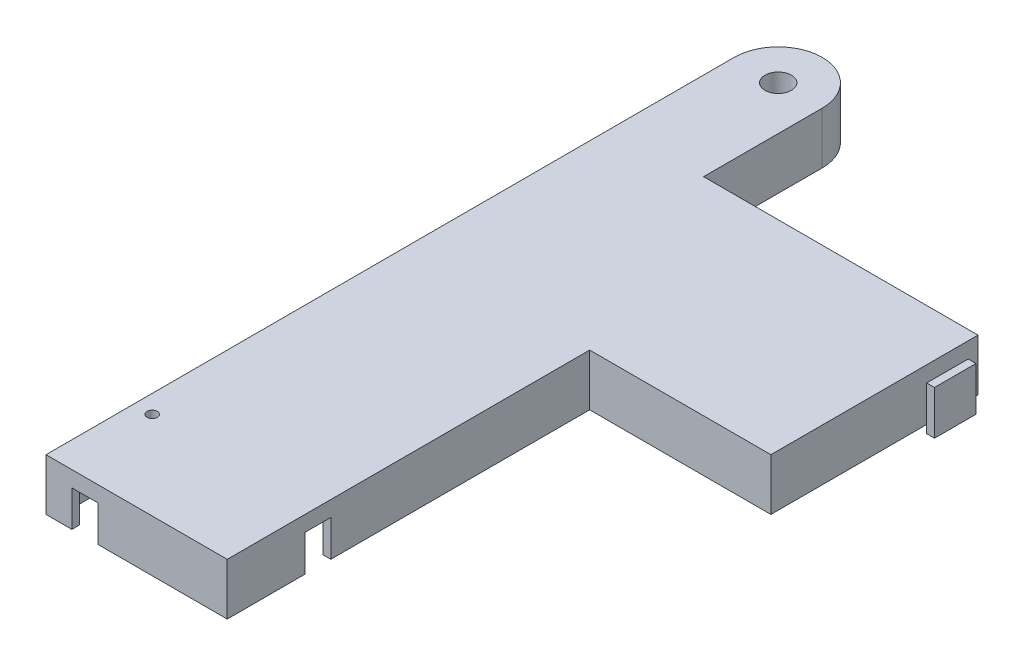
from build123d import *

# Parameters (mm, degrees)
CORNERBOSS_EXTRUDE1_DEPTH               = 20
SHELL2_T                                = -3
PADSKETCH3_R                            = 12
PADSKETCH3_R_2                          = 5
PADBOSS_EXTRUDE2_DEPTH                  = 10
STEPPERSHAFTHOLESKETCH4_R               = 5.1
STEPPERSHAFTHOLESKETCH4_R_2             = 2
STEPPERSHAFTCUT_EXTRUDE2_DEPTH          = 316.846451025
THREADEDNUTMOUNTHOLESSKETCH5_R          = 2
THREADEDNUTMOUNTHOLESCUT_EXTRUDE4_DEPTH = 10
TRPEGSKETCH1_W                          = 9.8
TRPEGSKETCH1_H                          = 13.9
TRPEGBOSS_EXTRUDE1_DEPTH                = 3.1
TRPEGCAPSKETCH2_W                       = 16
TRPEGCAPSKETCH2_H                       = 17
TRPEGCAPBOSS_EXTRUDE2_DEPTH             = 3
BOTTOMPEGHOLESKETCH3_W                  = 10
BOTTOMPEGHOLESKETCH3_H                  = 13.9
BOTTOMPEGHOLECUT_EXTRUDE1_DEPTH         = 3
BEDCENTERPEGHOLECUTSKETCH1_W            = 10
BEDCENTERPEGHOLECUTSKETCH1_H            = 14
BEDCENTERPEGHOLECUT_EXTRUDE1_DEPTH      = 3


with BuildPart() as part:
    # CornerrSketch1 → CornerBoss-Extrude1 (new body)
    with BuildSketch(Plane(origin=(0, 0, 0), x_dir=(1, 0, 0), z_dir=(0, 1, 0))):
        with BuildLine():
            Line((140, 220), (140, 140))
            Line((140, 140), (70, 140))
            Line((70, 140), (70, 0))
            Line((70, 0), (0, 0))
            Line((0, 0), (0, 265.825))
            ThreePointArc((0, 265.825), (17, 282.825), (34, 265.825))
            Line((34, 265.825), (34, 220))
            Line((34, 220), (140, 220))
        make_face()
    extrude(amount=CORNERBOSS_EXTRUDE1_DEPTH)

    # Shell2
    shell2_openings = [part.faces().sort_by_distance(p)[0] for p in [
        (50.460788317, 0, -139.249856422),
    ]]
    offset(amount=SHELL2_T, openings=shell2_openings, kind=Kind.INTERSECTION)

    # PadSketch3 → PadBoss-Extrude2 (add)
    with BuildSketch(Plane.XZ.offset(-17)):
        with Locations(Location((17, -265.825, 0), (0, 0, 90))):
            Circle(PADSKETCH3_R)
        with Locations((7, -34)):
            Circle(PADSKETCH3_R_2)
    extrude(amount=PADBOSS_EXTRUDE2_DEPTH)

    # StepperShaftHoleSketch4 → StepperShaftCut-Extrude2 (cut, through all)
    with BuildSketch(Plane.XZ.offset(-7)):
        with Locations(Location((17, -265.825, 0), (0, 0, 270))):
            Circle(STEPPERSHAFTHOLESKETCH4_R)
        with Locations(Location((7, -34, 0), (0, 0, 270))):
            Circle(STEPPERSHAFTHOLESKETCH4_R_2)
    extrude(amount=-STEPPERSHAFTCUT_EXTRUDE2_DEPTH, mode=Mode.SUBTRACT)

    # ThreadedNutMountHolesSketch5 → ThreadedNutMountHolesCut-Extrude4 (cut)
    with BuildSketch(Plane(origin=(0, 7, 0), x_dir=(-1, 0, 0), z_dir=(0, -1, 0))):
        with Locations(Location((-17, 273.825, 0), (0, 0, 90))):
            Circle(THREADEDNUTMOUNTHOLESSKETCH5_R)
        with Locations(Location((-9, 265.825, 0), (0, 0, 90))):
            Circle(THREADEDNUTMOUNTHOLESSKETCH5_R)
        with Locations(Location((-17, 257.825, 0), (0, 0, 90))):
            Circle(THREADEDNUTMOUNTHOLESSKETCH5_R)
        with Locations(Location((-25, 265.825, 0), (0, 0, 90))):
            Circle(THREADEDNUTMOUNTHOLESSKETCH5_R)
    extrude(amount=-THREADEDNUTMOUNTHOLESCUT_EXTRUDE4_DEPTH, mode=Mode.SUBTRACT)

    # TRPegSketch1 → TRPegBoss-Extrude1 (add)
    with BuildSketch(Plane(origin=(140, 0, 0), x_dir=(0, 0, -1), z_dir=(1, 0, 0))):
        with Locations((205, 6.95)):
            Rectangle(TRPEGSKETCH1_W, TRPEGSKETCH1_H)
    extrude(amount=TRPEGBOSS_EXTRUDE1_DEPTH)

    # TRPegCapSketch2 → TRPegCapBoss-Extrude2 (add)
    with BuildSketch(Plane(origin=(143.1, 0, 0), x_dir=(0, 0, -1), z_dir=(1, 0, 0))):
        with Locations((205.1, 8.5)):
            Rectangle(TRPEGCAPSKETCH2_W, TRPEGCAPSKETCH2_H)
    extrude(amount=TRPEGCAPBOSS_EXTRUDE2_DEPTH)

    # BottomPegHoleSketch3 → BottomPegHoleCut-Extrude1 (cut)
    with BuildSketch(Plane.XY):
        with Locations((15, 6.95)):
            Rectangle(BOTTOMPEGHOLESKETCH3_W, BOTTOMPEGHOLESKETCH3_H)
    extrude(amount=-BOTTOMPEGHOLECUT_EXTRUDE1_DEPTH, mode=Mode.SUBTRACT)

    # BedCenterPegHoleCutSketch1 → BedCenterPegHoleCut-Extrude1 (cut)
    with BuildSketch(Plane(origin=(70, 0, 0), x_dir=(0, 0, -1), z_dir=(1, 0, 0))):
        with Locations((35, 7)):
            Rectangle(BEDCENTERPEGHOLECUTSKETCH1_W, BEDCENTERPEGHOLECUTSKETCH1_H)
    extrude(amount=-BEDCENTERPEGHOLECUT_EXTRUDE1_DEPTH, mode=Mode.SUBTRACT)


solid = part.part
